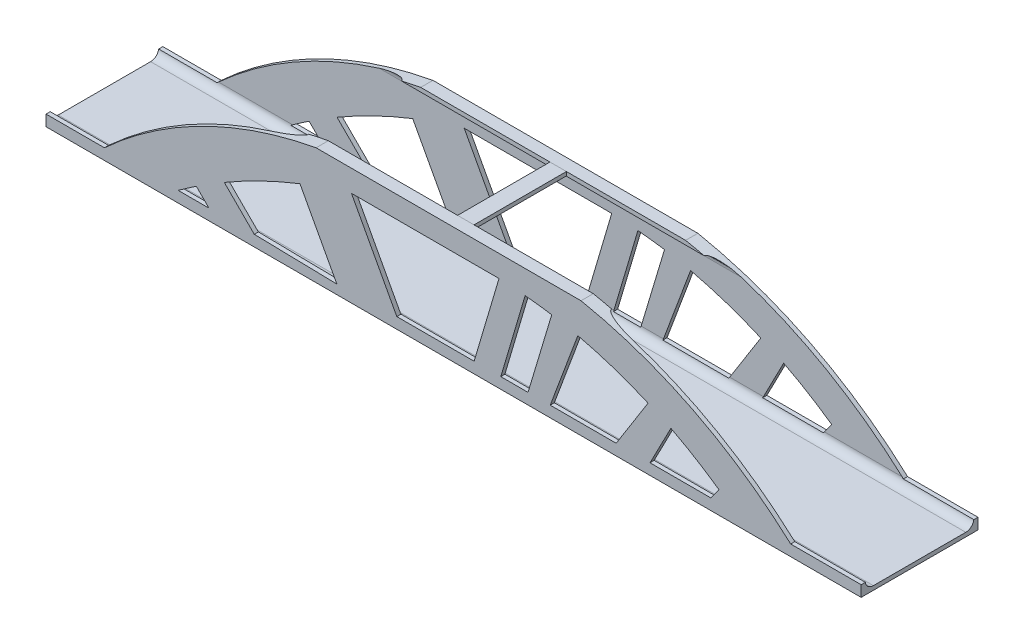
from build123d import *

# Parameters (mm, degrees)
BOSS_EXTRUDE1_DEPTH     = 1075
CUT_EXTRUDE1_DEPTH      = 7653.532305167
CUT_EXTRUDE1_DEPTH_BACK = 7653.532305167
SKETCH5_W               = 302.383880832
SKETCH5_H               = 2150
BOSS_EXTRUDE2_DEPTH     = 70


with BuildPart() as part:
    # Sketch1 → Boss-Extrude1 (new, symmetric)
    with BuildSketch(Plane.XY):
        with BuildLine():
            Line((-2530, 1075.000317032), (2344.599897209, 1075.000317032))
            ThreePointArc((2344.599897209, 1075.000317032), (4407.249810354, 365.377337752), (6203.287092397, -872.499682968))
            Line((6203.287092397, -872.499682968), (7500, -872.499682968))
            Line((7500, -872.499682968), (7499.99977297, -1075.000317032))
            Line((7499.99977297, -1075.000317032), (-7500, -1074.999772413))
            Line((-7500, -1074.999772413), (-7500, -872.499682968))
            Line((-7500, -872.499682968), (-6424.826662056, -872.499682968))
            ThreePointArc((-6424.826662056, -872.499682968), (-4615.015680989, 376.442769607), (-2530, 1075.000317032))
        make_face()
        with BuildLine():
            ThreePointArc((1806.155094546, 582.478715569), (1561.713088192, 616.139546066), (1316.303182053, 641.809060073))
            Line((1316.303182053, 641.809060073), (868.739855923, -872.499682968))
            Line((868.739855923, -872.499682968), (1369.985931107, -872.499682968))
            Line((1369.985931107, -872.499682968), (1806.155094546, 582.478715569))
        make_face(mode=Mode.SUBTRACT)
        with BuildLine():
            ThreePointArc((835.013703981, 672.923190827), (797.55231686, 674.054573087), (760.085783537, 675.000317032))
            Line((760.085783537, 675.000317032), (-1879.1568192, 675.000317032))
            Line((-1879.1568192, 675.000317032), (-1044.609704387, -872.499682968))
            Line((-1044.609704387, -872.499682968), (378.254403837, -872.499682968))
            Line((378.254403837, -872.499682968), (835.013703981, 672.923190827))
        make_face(mode=Mode.SUBTRACT)
        with BuildLine():
            ThreePointArc((-4733.10962669, -640.620236119), (-4901.561226224, -754.89575708), (-5067.706201147, -872.499682968))
            Line((-5067.706201147, -872.499682968), (-4501.230179842, -872.499682968))
            Line((-4501.230179842, -872.499682968), (-4733.10962669, -640.620236119))
        make_face(mode=Mode.SUBTRACT)
        with BuildLine():
            ThreePointArc((3579.05419078, 60.401493406), (2942.399920145, 304.587131085), (2286.341329526, 490.443020531))
            Line((2286.341329526, 490.443020531), (1778.144230839, -872.499682968))
            Line((1778.144230839, -872.499682968), (2991.920398852, -872.499682968))
            Line((2991.920398852, -872.499682968), (3579.05419078, 60.401493406))
        make_face(mode=Mode.SUBTRACT)
        with BuildLine():
            ThreePointArc((4883.348550373, -666.005495378), (4450.352550901, -382.76879992), (3999.005567619, -129.797532984))
            Line((3999.005567619, -129.797532984), (3614.856579636, -872.499682968))
            Line((3614.856579636, -872.499682968), (4731.852121641, -872.499682968))
            Line((4731.852121641, -872.499682968), (4883.348550373, -666.005495378))
        make_face(mode=Mode.SUBTRACT)
        with BuildLine():
            ThreePointArc((-2826.835366329, 353.901285175), (-3535.691308305, 42.90933788), (-4219.008249765, -320.781045922))
            Line((-4219.008249765, -320.781045922), (-3667.289612719, -872.499682968))
            Line((-3667.289612719, -872.499682968), (-2147.632767673, -905.543511608))
            Line((-2147.632767673, -905.543511608), (-2826.835366329, 353.901285175))
        make_face(mode=Mode.SUBTRACT)
    extrude(amount=BOSS_EXTRUDE1_DEPTH, both=True)

    # Sketch2 → Cut-Extrude1 (cut, two sides: drawn at the far end of the back side and taken through both)
    with BuildSketch(Plane(origin=(0, 0, 0), x_dir=(0, 0, -1), z_dir=(1, 0, 0)).offset(-CUT_EXTRUDE1_DEPTH_BACK)):
        with BuildLine():
            ThreePointArc((-1000, -850), (-999.575135199, -861.281796405), (-998.302947598, -872.499682968))
            ThreePointArc((-998.302947598, -872.499682968), (-947.788157654, -963.743027138), (-850, -1000))
            Line((-850, -1000), (850, -1000))
            ThreePointArc((850, -1000), (947.788157654, -963.743027138), (998.302947598, -872.499682968))
            ThreePointArc((998.302947598, -872.499682968), (999.575135199, -861.281796405), (1000, -850))
            Line((1000, -850), (1000, 850))
            ThreePointArc((1000, 850), (956.066017178, 956.066017178), (850, 1000))
            Line((850, 1000), (850, 1075.000317032))
            Line((850, 1075.000317032), (-850, 1075.000317032))
            Line((-850, 1075.000317032), (-850, 1000))
            ThreePointArc((-850, 1000), (-956.066017178, 956.066017178), (-1000, 850))
            Line((-1000, 850), (-1000, -850))
        make_face()
    extrude(amount=CUT_EXTRUDE1_DEPTH + CUT_EXTRUDE1_DEPTH_BACK, mode=Mode.SUBTRACT)

    # Sketch5 → Boss-Extrude2 (add)
    with BuildSketch(Plane(origin=(0, 1075, 0), x_dir=(1, 0, 0), z_dir=(0, 1, 0))):
        Rectangle(SKETCH5_W, SKETCH5_H)
    extrude(amount=-BOSS_EXTRUDE2_DEPTH)


solid = part.part
